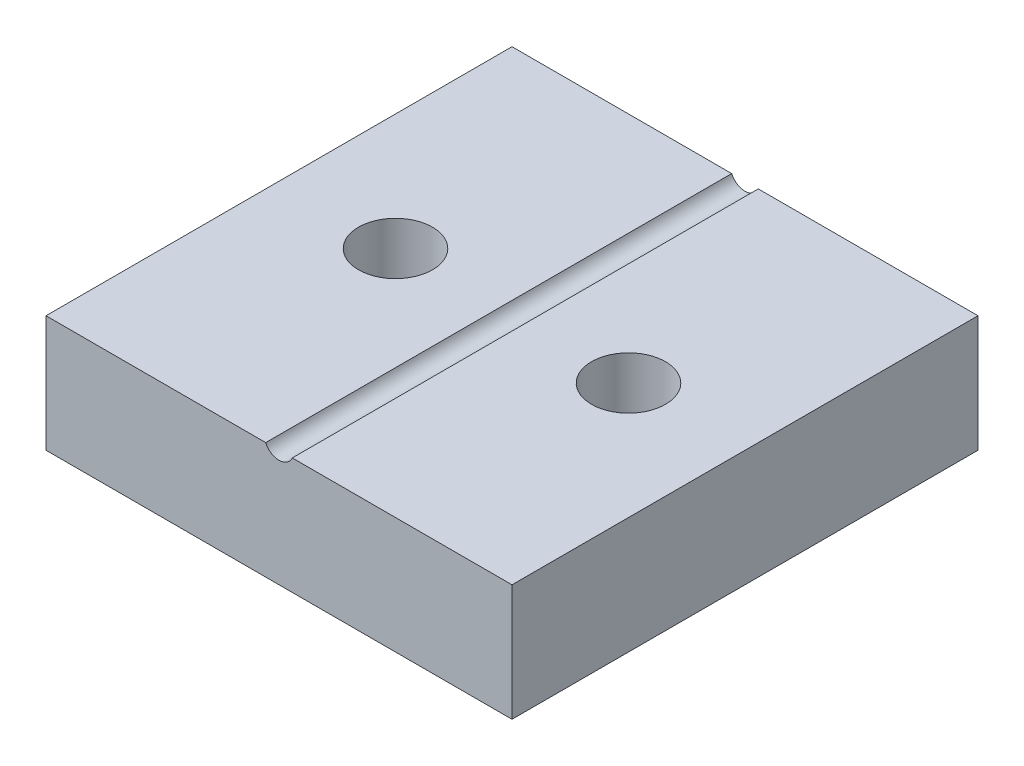
from build123d import *

# Parameters (mm, degrees)
SKETCH1_W           = 20
SKETCH1_H           = 20
BOSS_EXTRUDE1_DEPTH = 5
SKETCH2_R           = 0.6223
CUT_EXTRUDE1_DEPTH  = 65.157116795
SKETCH3_R           = 1.5875
CUT_EXTRUDE2_DEPTH  = 81.174749068


with BuildPart() as part:
    # Sketch1 → Boss-Extrude1 (new body)
    with BuildSketch(Plane(origin=(0, 0, 0), x_dir=(1, 0, 0), z_dir=(0, 1, 0))):
        with Locations((-50.754716981, 42.075471698)):
            Rectangle(SKETCH1_W, SKETCH1_H)
    extrude(amount=BOSS_EXTRUDE1_DEPTH)

    # Sketch2 → Cut-Extrude1 (cut, through all)
    with BuildSketch(Plane.XY.offset(-32.075471698)):
        with Locations((-50.754716981, 5.25)):
            Circle(SKETCH2_R)
    extrude(amount=-CUT_EXTRUDE1_DEPTH, mode=Mode.SUBTRACT)

    # Sketch3 → Cut-Extrude2 (cut, through all)
    with BuildSketch(Plane(origin=(0, 5, 0), x_dir=(1, 0, 0), z_dir=(0, 1, 0))):
        with Locations(Location((-55.754716981, 42.075471698, 0), (0, 0, 270))):
            Circle(SKETCH3_R)
        with Locations(Location((-45.754716981, 42.075471698, 0), (0, 0, 270))):
            Circle(SKETCH3_R)
    extrude(amount=-CUT_EXTRUDE2_DEPTH, mode=Mode.SUBTRACT)


solid = part.part
